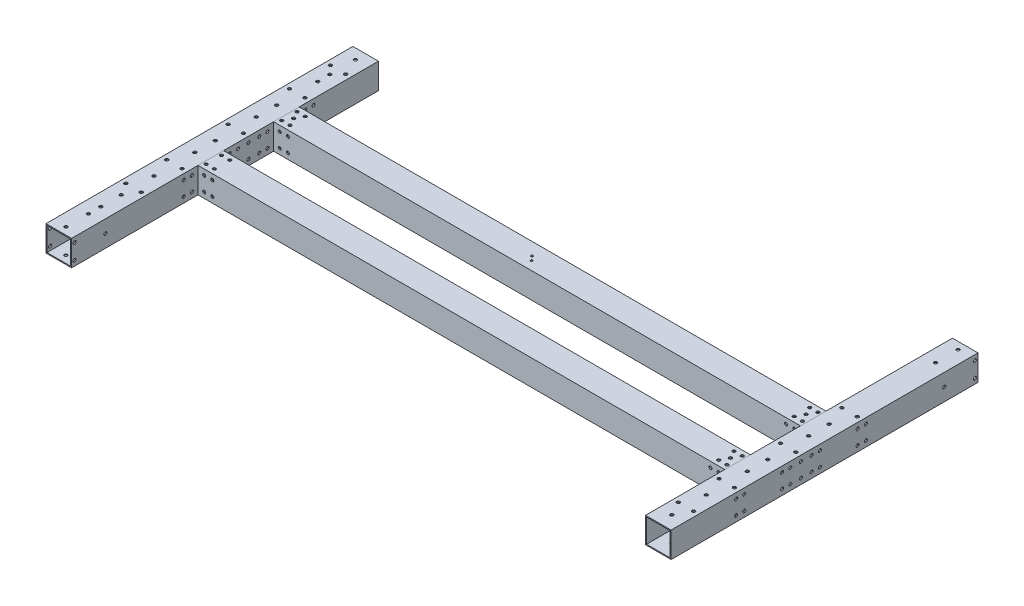
from build123d import *

# Parameters (mm, degrees)
F_20X20X1_1_DEPTH         = 541
F_20X20X1_1_DEPTH_BACK    = 1
SKETCH_1_W                = 25
SKETCH_1_H                = 25
SKETCH_1_W_2              = 23
SKETCH_1_H_2              = 23
SKETCH_1_ON_SEGMENT_2_W   = 25
SKETCH_1_ON_SEGMENT_2_H   = 25
SKETCH_1_ON_SEGMENT_2_W_2 = 23
SKETCH_1_ON_SEGMENT_2_H_2 = 23
F_20X20X1_1_2_DEPTH       = 542
SKETCH_1_ON_SEGMENT_3_W   = 25
SKETCH_1_ON_SEGMENT_3_H   = 25
SKETCH_1_ON_SEGMENT_3_W_2 = 23
SKETCH_1_ON_SEGMENT_3_H_2 = 23
F_20X20X1_1_3_DEPTH       = 300
SKETCH_1_ON_SEGMENT_4_W   = 25
SKETCH_1_ON_SEGMENT_4_H   = 25
SKETCH_1_ON_SEGMENT_4_W_2 = 23
SKETCH_1_ON_SEGMENT_4_H_2 = 23
F_20X20X1_1_4_DEPTH       = 300
SKETCH_2_R                = 1.5
CUT_EXTRUDE_1_DEPTH       = 603.894062004
CUT_EXTRUDE_2_DEPTH       = 592.592131455
CUT_EXTRUDE_2_DEPTH_BACK  = 592.592131455
SKETCH_3_R                = 1.5
SKETCH_4_R                = 1.55
CUT_EXTRUDE_3_DEPTH       = 592.592131455
SKETCH_5_R                = 1.55
CUT_EXTRUDE_4_DEPTH       = 603.894062004
SKETCH_6_R                = 1.5
CUT_EXTRUDE_5_DEPTH       = 596.750577003
SKETCH_7_R                = 1.05
CUT_EXTRUDE_6_DEPTH       = 592.592131455
CUT_EXTRUDE_7_DEPTH       = 580.531060427
CUT_EXTRUDE_7_DEPTH_BACK  = 580.531060427
SKETCH_8_R                = 1.5


with BuildPart() as part:
    # 草图1 → 方形管 20X20X1(1) (new, two sides: drawn at the far end of the back side and taken through both)
    with BuildSketch(Plane(origin=(0, 0, 0), x_dir=(0, 0, -1), z_dir=(1, 0, 0)).offset(-F_20X20X1_1_DEPTH_BACK)):
        Rectangle(SKETCH_1_W, SKETCH_1_H)
        Rectangle(SKETCH_1_W_2, SKETCH_1_H_2, mode=Mode.SUBTRACT)
    extrude(amount=F_20X20X1_1_DEPTH + F_20X20X1_1_DEPTH_BACK)

    # 方形管 20X20X1(1) end butt 1
    split(bisect_by=Plane.YZ.offset(12.5), keep=Keep.TOP)

    # 方形管 20X20X1(1) end butt 2
    split(bisect_by=Plane(origin=(527.5, 0, 0), x_dir=(0, -1, 0), z_dir=(-1, 0, 0)), keep=Keep.TOP)


with BuildPart() as body_2:
    # 草图1 on segment 2 (carried to segment 2) → 20X20X1_1 2 (new body)
    with BuildSketch(Plane(origin=(-1, 0, -73.9), x_dir=(0, 0, -1), z_dir=(1, 0, 0))):
        Rectangle(SKETCH_1_ON_SEGMENT_2_W, SKETCH_1_ON_SEGMENT_2_H)
        Rectangle(SKETCH_1_ON_SEGMENT_2_W_2, SKETCH_1_ON_SEGMENT_2_H_2, mode=Mode.SUBTRACT)
    extrude(amount=F_20X20X1_1_2_DEPTH)

    # 20X20X1_1 2 end butt 1
    split(bisect_by=Plane(origin=(12.5, 0, -73.9), x_dir=(0, 1, 0), z_dir=(1, 0, 0)), keep=Keep.TOP)

    # 20X20X1_1 2 end butt 2
    split(bisect_by=Plane(origin=(527.5, 0, -73.9), x_dir=(0, -1, 0), z_dir=(-1, 0, 0)), keep=Keep.TOP)


with BuildPart() as body_3:
    # 草图1 on segment 3 (carried to segment 3) → 20X20X1_1 3 (new body)
    with BuildSketch(Plane(origin=(0, 0, 136.1), x_dir=(-1, 0, 0), z_dir=(0, 0, -1))):
        Rectangle(SKETCH_1_ON_SEGMENT_3_W, SKETCH_1_ON_SEGMENT_3_H)
        Rectangle(SKETCH_1_ON_SEGMENT_3_W_2, SKETCH_1_ON_SEGMENT_3_H_2, mode=Mode.SUBTRACT)
    extrude(amount=F_20X20X1_1_3_DEPTH)


with BuildPart() as body_4:
    # 草图1 on segment 4 (carried to segment 4) → 20X20X1_1 4 (new body)
    with BuildSketch(Plane(origin=(540, 0, -210), x_dir=(1, 0, 0), z_dir=(0, 0, 1))):
        Rectangle(SKETCH_1_ON_SEGMENT_4_W, SKETCH_1_ON_SEGMENT_4_H)
        Rectangle(SKETCH_1_ON_SEGMENT_4_W_2, SKETCH_1_ON_SEGMENT_4_H_2, mode=Mode.SUBTRACT)
    extrude(amount=F_20X20X1_1_4_DEPTH)


with BuildPart() as cut_extrude_1_tool:
    # 草图2 → 切除-拉伸1 (new, through all)
    with BuildSketch(Plane(origin=(552.5, 0, 0), x_dir=(0, 0, -1), z_dir=(1, 0, 0))):
        with Locations(Location((36.95, 7, 0), (0, 0, 90))):
            Circle(SKETCH_2_R)
        with Locations(Location((36.95, -7, 0), (0, 0, 90))):
            Circle(SKETCH_2_R)
        with Locations(Location((26.5, 7, 0), (0, 0, 90))):
            Circle(SKETCH_2_R)
        with Locations(Location((26.5, -7, 0), (0, 0, 90))):
            Circle(SKETCH_2_R)
        with Locations(Location((47.4, -7, 0), (0, 0, 270))):
            Circle(SKETCH_2_R)
        with Locations(Location((47.4, 7, 0), (0, 0, 270))):
            Circle(SKETCH_2_R)
    extrude(amount=-CUT_EXTRUDE_1_DEPTH)


with BuildPart() as body_3_1:
    add(body_3.part)

    # 切除-拉伸1: cut by cut_extrude_1_tool
    add(cut_extrude_1_tool.part, mode=Mode.SUBTRACT)


with BuildPart() as body_4_1:
    add(body_4.part)

    # 切除-拉伸1: cut by cut_extrude_1_tool
    add(cut_extrude_1_tool.part, mode=Mode.SUBTRACT)


with BuildPart() as cut_extrude_2_tool:
    # 草图3 → 切除-拉伸2 (new, two sides: drawn at the far end of the back side and taken through both)
    with BuildSketch(Plane(origin=(0, 12.5, 0), x_dir=(1, 0, 0), z_dir=(0, 1, 0)).offset(-CUT_EXTRUDE_2_DEPTH_BACK)):
        with Locations((15.5, 7.5)):
            Circle(SKETCH_3_R)
        with Locations((15.5, -7.5)):
            Circle(SKETCH_3_R)
        with Locations((23.5, -7.5)):
            Circle(SKETCH_3_R)
        with Locations((23.5, 7.5)):
            Circle(SKETCH_3_R)
        with Locations((15.5, 66.4)):
            Circle(SKETCH_3_R)
        with Locations((23.5, 66.4)):
            Circle(SKETCH_3_R)
        with Locations((23.5, 81.4)):
            Circle(SKETCH_3_R)
        with Locations((15.5, 81.4)):
            Circle(SKETCH_3_R)
        with Locations((524.5, 7.5)):
            Circle(SKETCH_3_R)
        with Locations((516.5, 7.5)):
            Circle(SKETCH_3_R)
        with Locations((516.5, -7.5)):
            Circle(SKETCH_3_R)
        with Locations((524.5, -7.5)):
            Circle(SKETCH_3_R)
        with Locations((524.5, 81.4)):
            Circle(SKETCH_3_R)
        with Locations((516.5, 81.4)):
            Circle(SKETCH_3_R)
        with Locations((516.5, 66.4)):
            Circle(SKETCH_3_R)
        with Locations((524.5, 66.4)):
            Circle(SKETCH_3_R)
    extrude(amount=CUT_EXTRUDE_2_DEPTH + CUT_EXTRUDE_2_DEPTH_BACK)


with BuildPart() as part_1:
    add(part.part)

    # 切除-拉伸2: cut by cut_extrude_2_tool
    add(cut_extrude_2_tool.part, mode=Mode.SUBTRACT)


with BuildPart() as body_2_1:
    add(body_2.part)

    # 切除-拉伸2: cut by cut_extrude_2_tool
    add(cut_extrude_2_tool.part, mode=Mode.SUBTRACT)


with BuildPart() as cut_extrude_3_tool:
    # 草图4 → 切除-拉伸3 (new, through all)
    with BuildSketch(Plane(origin=(0, 12.5, 0), x_dir=(1, 0, 0), z_dir=(0, 1, 0))):
        with Locations(Location((0, -75, 0), (0, 0, 180))):
            Circle(SKETCH_4_R)
        with Locations(Location((0, -95, 0), (0, 0, 180))):
            Circle(SKETCH_4_R)
        with Locations(Location((0, 153.9, 0), (0, 0, 180))):
            Circle(SKETCH_4_R)
        with Locations(Location((0, 128.9, 0), (0, 0, 180))):
            Circle(SKETCH_4_R)
        with Locations((0, 116.95)):
            Circle(SKETCH_4_R)
        with Locations((7.5, 136.9)):
            Circle(SKETCH_4_R)
        with Locations(Location((19.5, 73.907352941, 0), (0, 0, 180))):
            Circle(SKETCH_4_R)
        with Locations(Location((-7.5, -63, 0), (0, 0, 180))):
            Circle(SKETCH_4_R)
        with Locations(Location((7.5, -63, 0), (0, 0, 180))):
            Circle(SKETCH_4_R)
        with Locations(Location((0, -43.05, 0), (0, 0, 180))):
            Circle(SKETCH_4_R)
        with Locations(Location((-7.5, -23.05, 0), (0, 0, 180))):
            Circle(SKETCH_4_R)
        with Locations(Location((7.5, -23.05, 0), (0, 0, 180))):
            Circle(SKETCH_4_R)
        with Locations(Location((0, -3.05, 0), (0, 0, 180))):
            Circle(SKETCH_4_R)
        with Locations(Location((0, 16.95, 0), (0, 0, 180))):
            Circle(SKETCH_4_R)
        with Locations(Location((-7.5, 36.95, 0), (0, 0, 180))):
            Circle(SKETCH_4_R)
        with Locations(Location((7.5, 36.95, 0), (0, 0, 180))):
            Circle(SKETCH_4_R)
        with Locations(Location((0, 56.95, 0), (0, 0, 180))):
            Circle(SKETCH_4_R)
        with Locations(Location((0, 76.95, 0), (0, 0, 180))):
            Circle(SKETCH_4_R)
        with Locations(Location((-7.5, 96.95, 0), (0, 0, 180))):
            Circle(SKETCH_4_R)
        with Locations(Location((7.5, 96.95, 0), (0, 0, 180))):
            Circle(SKETCH_4_R)
        with Locations((-7.5, 136.9)):
            Circle(SKETCH_4_R)
        with Locations(Location((0, -129.1, 0), (0, 0, 180))):
            Circle(SKETCH_4_R)
        with Locations(Location((0, -107.1, 0), (0, 0, 180))):
            Circle(SKETCH_4_R)
        with Locations(Location((532.5, -63, 0), (0, 0, 180))):
            Circle(SKETCH_4_R)
        with Locations(Location((547.5, -63, 0), (0, 0, 180))):
            Circle(SKETCH_4_R)
        with Locations(Location((540, -43.05, 0), (0, 0, 180))):
            Circle(SKETCH_4_R)
        with Locations(Location((532.5, -23.05, 0), (0, 0, 180))):
            Circle(SKETCH_4_R)
        with Locations(Location((547.5, -23.05, 0), (0, 0, 180))):
            Circle(SKETCH_4_R)
        with Locations(Location((540, -3.05, 0), (0, 0, 180))):
            Circle(SKETCH_4_R)
        with Locations(Location((540, 16.95, 0), (0, 0, 180))):
            Circle(SKETCH_4_R)
        with Locations(Location((532.5, 36.95, 0), (0, 0, 180))):
            Circle(SKETCH_4_R)
        with Locations(Location((547.5, 36.95, 0), (0, 0, 180))):
            Circle(SKETCH_4_R)
        with Locations(Location((540, 56.95, 0), (0, 0, 180))):
            Circle(SKETCH_4_R)
        with Locations(Location((540, 76.95, 0), (0, 0, 180))):
            Circle(SKETCH_4_R)
        with Locations(Location((547.5, 96.95, 0), (0, 0, 180))):
            Circle(SKETCH_4_R)
        with Locations(Location((532.5, 96.95, 0), (0, 0, 180))):
            Circle(SKETCH_4_R)
        with Locations(Location((520.5, 0, 0), (0, 0, 180))):
            Circle(SKETCH_4_R)
        with Locations(Location((520.5, 73.907352941, 0), (0, 0, 180))):
            Circle(SKETCH_4_R)
        with Locations(Location((540, -76.8, 0), (0, 0, 180))):
            Circle(SKETCH_4_R)
        with Locations((540, -94.8)):
            Circle(SKETCH_4_R)
        with Locations(Location((539.975, 181, 0), (0, 0, 180))):
            Circle(SKETCH_4_R)
        with Locations(Location((539.975, 203, 0), (0, 0, 180))):
            Circle(SKETCH_4_R)
    extrude(amount=-CUT_EXTRUDE_3_DEPTH)


with BuildPart() as part_2:
    add(part_1.part)

    # 切除-拉伸3: cut by cut_extrude_3_tool
    add(cut_extrude_3_tool.part, mode=Mode.SUBTRACT)


with BuildPart() as body_2_2:
    add(body_2_1.part)

    # 切除-拉伸3: cut by cut_extrude_3_tool
    add(cut_extrude_3_tool.part, mode=Mode.SUBTRACT)


with BuildPart() as body_3_2:
    add(body_3_1.part)

    # 切除-拉伸3: cut by cut_extrude_3_tool
    add(cut_extrude_3_tool.part, mode=Mode.SUBTRACT)


with BuildPart() as body_4_2:
    add(body_4_1.part)

    # 切除-拉伸3: cut by cut_extrude_3_tool
    add(cut_extrude_3_tool.part, mode=Mode.SUBTRACT)


with BuildPart() as cut_extrude_4_tool:
    # 草图5 → 切除-拉伸4 (new, through all)
    with BuildSketch(Plane(origin=(552.5, 0, 0), x_dir=(0, 0, -1), z_dir=(1, 0, 0))):
        with Locations(Location((207, 7.5, 0), (0, 0, 90))):
            Circle(SKETCH_5_R)
        with Locations(Location((177, 0, 0), (0, 0, 90))):
            Circle(SKETCH_5_R)
        with Locations(Location((-103.1, 0, 0), (0, 0, 270))):
            Circle(SKETCH_5_R)
        with Locations(Location((-133.1, 7.5, 0), (0, 0, 270))):
            Circle(SKETCH_5_R)
        with Locations(Location((-133.1, -7.5, 0), (0, 0, 270))):
            Circle(SKETCH_5_R)
        with Locations(Location((207, -7.5, 0), (0, 0, 90))):
            Circle(SKETCH_5_R)
    extrude(amount=-CUT_EXTRUDE_4_DEPTH)


with BuildPart() as body_3_3:
    add(body_3_2.part)

    # 切除-拉伸4: cut by cut_extrude_4_tool
    add(cut_extrude_4_tool.part, mode=Mode.SUBTRACT)


with BuildPart() as body_4_3:
    add(body_4_2.part)

    # 切除-拉伸4: cut by cut_extrude_4_tool
    add(cut_extrude_4_tool.part, mode=Mode.SUBTRACT)


with BuildPart() as cut_extrude_5_tool:
    # 草图6 → 切除-拉伸5 (new, through all)
    with BuildSketch(Plane(origin=(0, 0, -86.4), x_dir=(-1, 0, 0), z_dir=(0, 0, -1))):
        with Locations(Location((-26.5, -7, 0), (0, 0, 270))):
            Circle(SKETCH_6_R)
        with Locations(Location((-18.5, -7, 0), (0, 0, 270))):
            Circle(SKETCH_6_R)
        with Locations(Location((-18.5, 7, 0), (0, 0, 270))):
            Circle(SKETCH_6_R)
        with Locations(Location((-26.5, 7, 0), (0, 0, 270))):
            Circle(SKETCH_6_R)
        with Locations(Location((-513.5, 7, 0), (0, 0, 270))):
            Circle(SKETCH_6_R)
        with Locations(Location((-521.5, 7, 0), (0, 0, 270))):
            Circle(SKETCH_6_R)
        with Locations(Location((-521.5, -7, 0), (0, 0, 270))):
            Circle(SKETCH_6_R)
        with Locations(Location((-513.5, -7, 0), (0, 0, 270))):
            Circle(SKETCH_6_R)
    extrude(amount=-CUT_EXTRUDE_5_DEPTH)


with BuildPart() as part_3:
    add(part_2.part)

    # 切除-拉伸5: cut by cut_extrude_5_tool
    add(cut_extrude_5_tool.part, mode=Mode.SUBTRACT)


with BuildPart() as body_2_3:
    add(body_2_2.part)

    # 切除-拉伸5: cut by cut_extrude_5_tool
    add(cut_extrude_5_tool.part, mode=Mode.SUBTRACT)

    # 草图7 → 切除-拉伸6 (cut, through all)
    with BuildSketch(Plane(origin=(0, 12.5, 0), x_dir=(1, 0, 0), z_dir=(0, 1, 0))):
        with Locations(Location((256.188305844, 69.99, 0), (0, 0, 180))):
            Circle(SKETCH_7_R)
        with Locations(Location((252.5, 74.07, 0), (0, 0, 180))):
            Circle(SKETCH_7_R)
    extrude(amount=-CUT_EXTRUDE_6_DEPTH, mode=Mode.SUBTRACT)


with BuildPart() as cut_extrude_7_tool:
    # 草图8 → 切除-拉伸7 (new, two sides: drawn at the far end of the back side and taken through both)
    with BuildSketch(Plane(origin=(12.5, 0, 0), x_dir=(0, 0, -1), z_dir=(1, 0, 0)).offset(-CUT_EXTRUDE_7_DEPTH_BACK)):
        with Locations(Location((100.4, -7, 0), (0, 0, 90))):
            Circle(SKETCH_8_R)
        with Locations(Location((92.4, -7, 0), (0, 0, 90))):
            Circle(SKETCH_8_R)
        with Locations(Location((100.4, 7, 0), (0, 0, 90))):
            Circle(SKETCH_8_R)
        with Locations(Location((92.4, 7, 0), (0, 0, 90))):
            Circle(SKETCH_8_R)
        with Locations(Location((55.414705882, 7, 0), (0, 0, 270))):
            Circle(SKETCH_8_R)
        with Locations(Location((55.414705882, -7, 0), (0, 0, 270))):
            Circle(SKETCH_8_R)
        with Locations(Location((18.485294118, -7, 0), (0, 0, 90))):
            Circle(SKETCH_8_R)
        with Locations(Location((18.485294118, 7, 0), (0, 0, 90))):
            Circle(SKETCH_8_R)
        with Locations(Location((-18.5, 7, 0), (0, 0, 270))):
            Circle(SKETCH_8_R)
        with Locations(Location((-26.5, 7, 0), (0, 0, 270))):
            Circle(SKETCH_8_R)
        with Locations(Location((-18.5, -7, 0), (0, 0, 270))):
            Circle(SKETCH_8_R)
        with Locations(Location((-26.5, -7, 0), (0, 0, 270))):
            Circle(SKETCH_8_R)
    extrude(amount=CUT_EXTRUDE_7_DEPTH + CUT_EXTRUDE_7_DEPTH_BACK)


with BuildPart() as body_3_4:
    add(body_3_3.part)

    # 切除-拉伸7: cut by cut_extrude_7_tool
    add(cut_extrude_7_tool.part, mode=Mode.SUBTRACT)


with BuildPart() as body_4_4:
    add(body_4_3.part)

    # 切除-拉伸7: cut by cut_extrude_7_tool
    add(cut_extrude_7_tool.part, mode=Mode.SUBTRACT)


solid = Compound([part_3.part, body_2_3.part, body_3_4.part, body_4_4.part])
